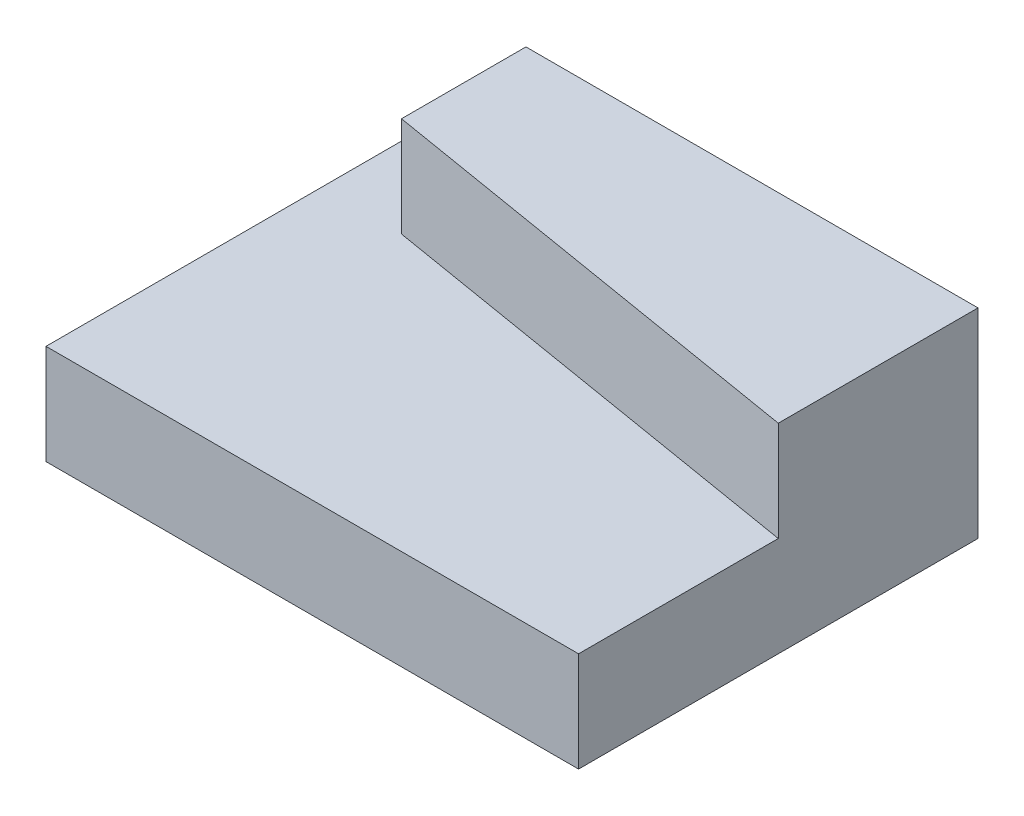
from build123d import *

# Parameters (mm, degrees)
SKETCH14_W     = 101.6
SKETCH14_H     = 76.2
EXTRUDE5_DEPTH = 19.05
EXTRUDE6_DEPTH = 19.05


with BuildPart() as part:
    # Sketch14 → Extrude5 (new body)
    with BuildSketch(Plane(origin=(0, 0, 0), x_dir=(1, 0, 0), z_dir=(0, 1, 0))):
        with Locations((50.8, 38.1)):
            Rectangle(SKETCH14_W, SKETCH14_H)
    extrude(amount=-EXTRUDE5_DEPTH)

    # Sketch15 → Extrude6 (add)
    with BuildSketch(Plane(origin=(0, 0, 0), x_dir=(1, 0, 0), z_dir=(0, 1, 0))):
        Polygon((101.6, 38.1), (15.359566814, 52.459402124), (15.359566814, 76.2), (101.6, 76.2), align=None)
    extrude(amount=EXTRUDE6_DEPTH)


solid = part.part
